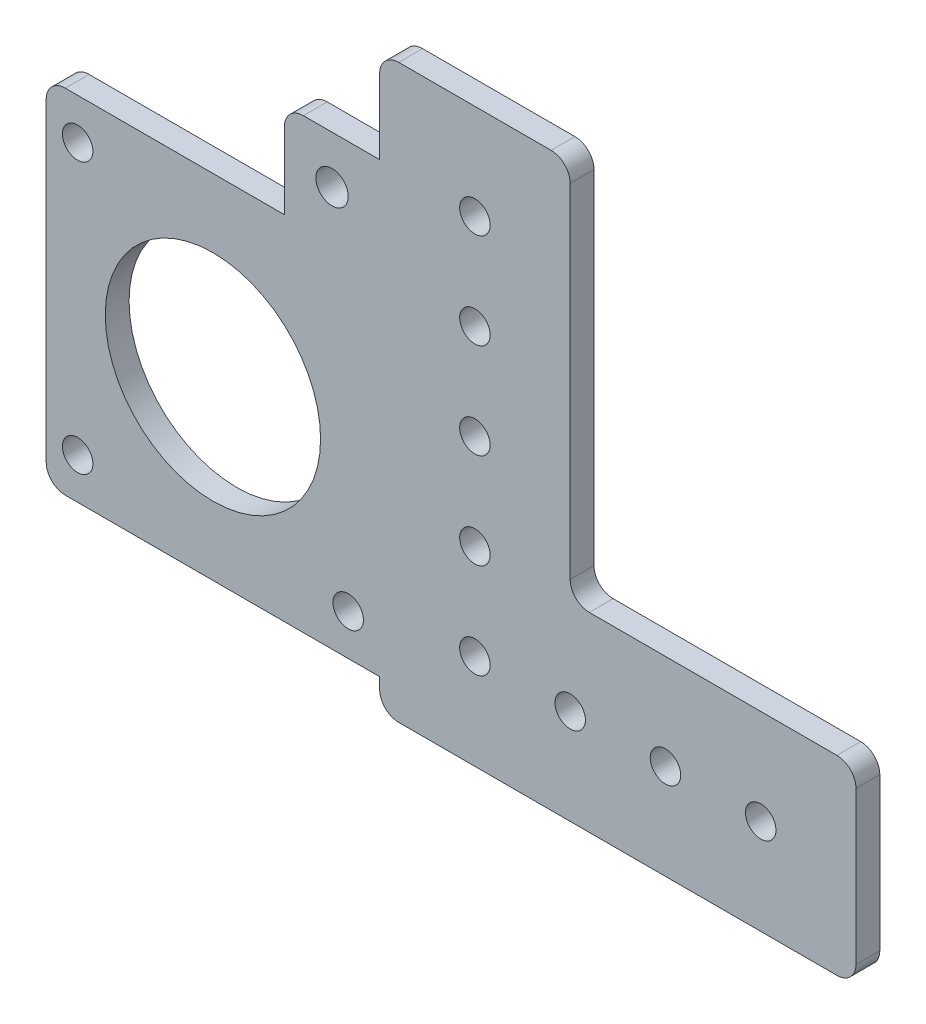
from build123d import *

# Parameters (mm, degrees)
SKETCH1_R           = 2.032
SKETCH1_R_2         = 14.351
SKETCH1_W           = 25.4
SKETCH1_H           = 76.2
BOSS_EXTRUDE1_DEPTH = 3.175
SKETCH2_R           = 2.032
CUT_EXTRUDE1_DEPTH  = 69.759094853
SKETCH4_W           = 3.175
SKETCH4_H           = 25.4
BOSS_EXTRUDE2_DEPTH = 38.1
SKETCH5_R           = 2.032
CUT_EXTRUDE2_DEPTH  = 69.759094853
FILLET5_R           = 2.54
SKETCH6_W           = 12.7
SKETCH6_H           = 12.7
SKETCH6_R           = 2.159
BOSS_EXTRUDE3_DEPTH = 3.175
FILLET6_R           = 2.54


with BuildPart() as part:
    # Sketch1 → Boss-Extrude1 (new body)
    # profile 1 of 2: a face of its own
    with BuildSketch(Plane.XY):
        Polygon((-57.15, -34.095), (-12.7, -34.095), (-12.7, -24.638), (-12.7, 12.895), (-57.15, 12.895), align=None)
        with Locations((-52.959, -28.634)):
            Circle(SKETCH1_R, mode=Mode.SUBTRACT)
        with Locations((-34.925, -10.6)):
            Circle(SKETCH1_R_2, mode=Mode.SUBTRACT)
        with Locations((-16.891, -28.634)):
            Circle(SKETCH1_R, mode=Mode.SUBTRACT)
        with Locations((-52.959, 7.434)):
            Circle(SKETCH1_R, mode=Mode.SUBTRACT)
    # profile 2 of 2: a face of its own
    with BuildSketch(Plane.XY):
        Rectangle(SKETCH1_W, SKETCH1_H)
    extrude(amount=BOSS_EXTRUDE1_DEPTH)

    # Sketch2 → Cut-Extrude1 (cut, through all)
    with BuildSketch(Plane.XY.offset(3.175)):
        Circle(SKETCH2_R)
        with Locations((0, 12.7)):
            Circle(SKETCH2_R)
        with Locations((0, 25.4)):
            Circle(SKETCH2_R)
        with Locations((0, -12.7)):
            Circle(SKETCH2_R)
        with Locations((0, -25.4)):
            Circle(SKETCH2_R)
    extrude(amount=-CUT_EXTRUDE1_DEPTH, mode=Mode.SUBTRACT)

    # Sketch4 → Boss-Extrude2 (add)
    with BuildSketch(Plane(origin=(12.7, 0, 0), x_dir=(0, 0, -1), z_dir=(1, 0, 0))):
        with Locations((-1.5875, -25.4)):
            Rectangle(SKETCH4_W, SKETCH4_H)
    extrude(amount=BOSS_EXTRUDE2_DEPTH)

    # Sketch5 → Cut-Extrude2 (cut, through all)
    with BuildSketch(Plane(origin=(0, 0, 0), x_dir=(-1, 0, 0), z_dir=(0, 0, -1))):
        with Locations(Location((0, -25.4, 0), (0, 0, 180))):
            Circle(SKETCH5_R)
        with Locations((-12.7, -25.4)):
            Circle(SKETCH5_R)
        with Locations((-25.4, -25.4)):
            Circle(SKETCH5_R)
        with Locations((-38.1, -25.4)):
            Circle(SKETCH5_R)
    extrude(amount=-CUT_EXTRUDE2_DEPTH, mode=Mode.SUBTRACT)

    # Fillet5
    fillet5_edges = [part.edges().sort_by_distance(p)[0] for p in [
        (-12.7, -38.1, 1.5875),
        (-57.15, -34.095, 1.5875),
        (-57.15, 12.895, 1.5875),
        (-12.7, 12.895, 1.5875),
        (-12.7, 38.1, 1.5875),
        (12.7, 38.1, 1.5875),
        (12.7, -12.7, 1.5875),
        (50.8, -38.1, 1.5875),
        (50.8, -12.7, 1.5875),
    ]]
    fillet(fillet5_edges, radius=FILLET5_R)

    # Sketch6 → Boss-Extrude3 (add)
    with BuildSketch(Plane.XY.offset(3.175)):
        with Locations((-19.05, 19.245)):
            Rectangle(SKETCH6_W, SKETCH6_H)
        with Locations((-19.05, 19.245)):
            Circle(SKETCH6_R, mode=Mode.SUBTRACT)
    extrude(amount=-BOSS_EXTRUDE3_DEPTH)

    # Fillet6
    fillet6_edges = [part.edges().sort_by_distance(p)[0] for p in [
        (-25.4, 25.595, 1.5875),
    ]]
    fillet(fillet6_edges, radius=FILLET6_R)


solid = part.part
